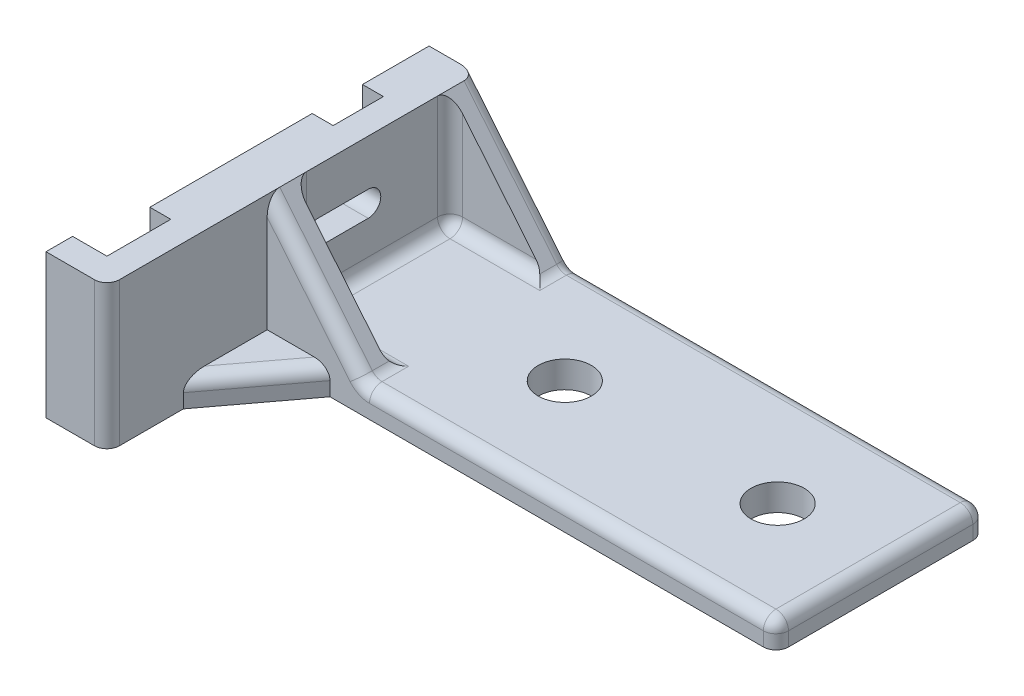
from build123d import *

# Parameters (mm, degrees)
SKETCH2_W           = 50
SKETCH2_H           = 25
SKETCH2_R           = 3.175
BOSS_EXTRUDE1_DEPTH = 3.175
SKETCH11_W          = 18
SKETCH11_H          = 25
BOSS_EXTRUDE4_DEPTH = 3.175
SKETCH12_W          = 44.125
SKETCH12_H          = 17.175
BOSS_EXTRUDE5_DEPTH = 7.275
SKETCH13_W          = 45.360945172
SKETCH13_H          = 22.695099396
CUT_EXTRUDE1_DEPTH  = 1.6
CUT_EXTRUDE2_DEPTH  = 76.525368255
BOSS_EXTRUDE6_DEPTH = 3.175
BOSS_EXTRUDE7_DEPTH = 3.175
FILLET7_R           = 1.5
SKETCH17_W          = 2.5
SKETCH17_H          = 7.62
SKETCH17_H_2        = 6
CUT_EXTRUDE3_DEPTH  = 14


with BuildPart() as part:
    # Sketch2 → Boss-Extrude1 (new body)
    with BuildSketch(Plane(origin=(0, 0, 0), x_dir=(1, 0, 0), z_dir=(0, 1, 0))):
        Rectangle(SKETCH2_W, SKETCH2_H)
        with Locations(Location((-12.7, 0, 0), (0, 0, 270))):
            Circle(SKETCH2_R, mode=Mode.SUBTRACT)
        with Locations(Location((12.7, 0, 0), (0, 0, 270))):
            Circle(SKETCH2_R, mode=Mode.SUBTRACT)
    extrude(amount=BOSS_EXTRUDE1_DEPTH)

    # Sketch11 → Boss-Extrude4 (add)
    with BuildSketch(Plane(origin=(0, 0, 0), x_dir=(1, 0, 0), z_dir=(0, 1, 0))):
        with Locations((-34, 0)):
            Rectangle(SKETCH11_W, SKETCH11_H)
    extrude(amount=BOSS_EXTRUDE4_DEPTH)

    # Sketch12 → Boss-Extrude5 (add)
    with BuildSketch(Plane.ZY.offset(43)):
        with Locations((9.5625, 8.5875)):
            Rectangle(SKETCH12_W, SKETCH12_H)
    extrude(amount=-BOSS_EXTRUDE5_DEPTH)

    # Sketch13 → Cut-Extrude1 (cut)
    with BuildSketch(Plane.ZY.offset(43)):
        with Locations((5.769527414, 14.522549698)):
            Rectangle(SKETCH13_W, SKETCH13_H)
    extrude(amount=-CUT_EXTRUDE1_DEPTH, mode=Mode.SUBTRACT)

    # Sketch14 → Cut-Extrude2 (cut, through all)
    with BuildSketch(Plane.ZY.offset(41.4)):
        with BuildLine():
            Line((6.45, 8.675), (0.442633339, 8.675))
            ThreePointArc((0.442633339, 8.675), (-1.057366661, 10.175), (0.442633339, 11.675))
            Line((0.442633339, 11.675), (6.45, 11.675))
            ThreePointArc((6.45, 11.675), (7.95, 10.175), (6.45, 8.675))
        make_face()
    extrude(amount=-CUT_EXTRUDE2_DEPTH, mode=Mode.SUBTRACT)

    # Sketch15 → Boss-Extrude6 (add)
    with BuildSketch(Plane(origin=(0, 0, -12.5), x_dir=(-1, 0, 0), z_dir=(0, 0, -1))):
        Polygon((35.725, 17.175), (24.225, 3.175), (35.725, 3.175), align=None)
    boss_extrude6 = extrude(amount=-BOSS_EXTRUDE6_DEPTH)

    # Mirror1: Boss-Extrude6 across plane
    add(boss_extrude6.mirror(Plane.XY))

    # Sketch16 → Boss-Extrude7 (add)
    with BuildSketch(Plane.XZ):
        Polygon((-35.725, 12.5), (-28.225, 12.5), (-35.725, 22.5), align=None)
    extrude(amount=-BOSS_EXTRUDE7_DEPTH)

    # Fillet7
    fillet7_edges = [part.edges().sort_by_distance(p)[0] for p in [
        (-29.975, 10.175, 12.5),
        (-29.975, 10.175, -12.5),
        (0.3875, 3.175, 12.5),
        (25, 1.5875, 12.5),
        (25, 3.175, 0),
        (25, 1.5875, -12.5),
        (0.3875, 3.175, -12.5),
        (-35.725, 10.175, -9.325),
        (-29.975, 3.175, -9.325),
        (-29.975, 3.175, 9.325),
        (-35.725, 10.175, 9.325),
        (-35.725, 3.175, 0),
        (-31.975, 3.175, 17.5),
        (-24.225, 3.175, -10.9125),
        (-24.225, 3.175, 10.9125),
        (-35.725, 8.5875, 31.625),
    ]]
    fillet(fillet7_edges, radius=FILLET7_R)

    # Sketch17 → Cut-Extrude3 (cut)
    with BuildSketch(Plane(origin=(0, 17.175, 0), x_dir=(1, 0, 0), z_dir=(0, 1, 0))):
        with Locations((-40.15, -24.64)):
            Rectangle(SKETCH17_W, SKETCH17_H)
        with Locations((-40.15, 1.55)):
            Rectangle(SKETCH17_W, SKETCH17_H_2)
    extrude(amount=-CUT_EXTRUDE3_DEPTH, mode=Mode.SUBTRACT)


solid = part.part
